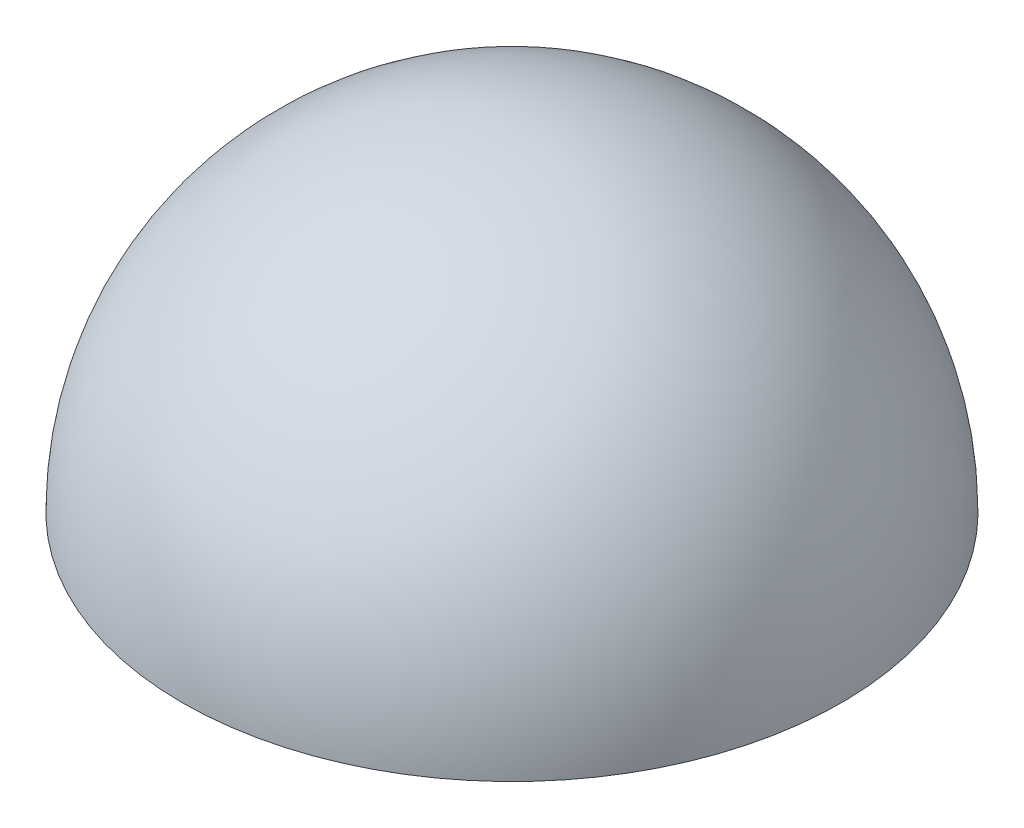
from build123d import *

# Parameters (mm, degrees)
CUT_EXTRUDE1_DEPTH      = 16.588457268
CUT_EXTRUDE1_DEPTH_BACK = 16.588457268
SKETCH2_W               = 19.230708204
SKETCH2_H               = 9.198847427


with BuildPart() as part:
    # Sketch1 → Revolve1 (revolve)
    with BuildSketch(Plane(origin=(0, 0, 0), x_dir=(1, 0, 0), z_dir=(0, 1, 0))):
        with BuildLine():
            Line((0, 9), (0, -9))
            ThreePointArc((0, -9), (-9, 0), (0, 9))
        make_face()
    revolve(axis=Axis((0, 0, -9), (0, 0, 1)))

    # Sketch2 → Cut-Extrude1 (cut, two sides: drawn at the far end of the back side and taken through both)
    with BuildSketch(Plane.XY.offset(-CUT_EXTRUDE1_DEPTH_BACK)):
        with Locations((0.202303242, -4.599423714)):
            Rectangle(SKETCH2_W, SKETCH2_H)
    extrude(amount=CUT_EXTRUDE1_DEPTH + CUT_EXTRUDE1_DEPTH_BACK, mode=Mode.SUBTRACT)


solid = part.part
